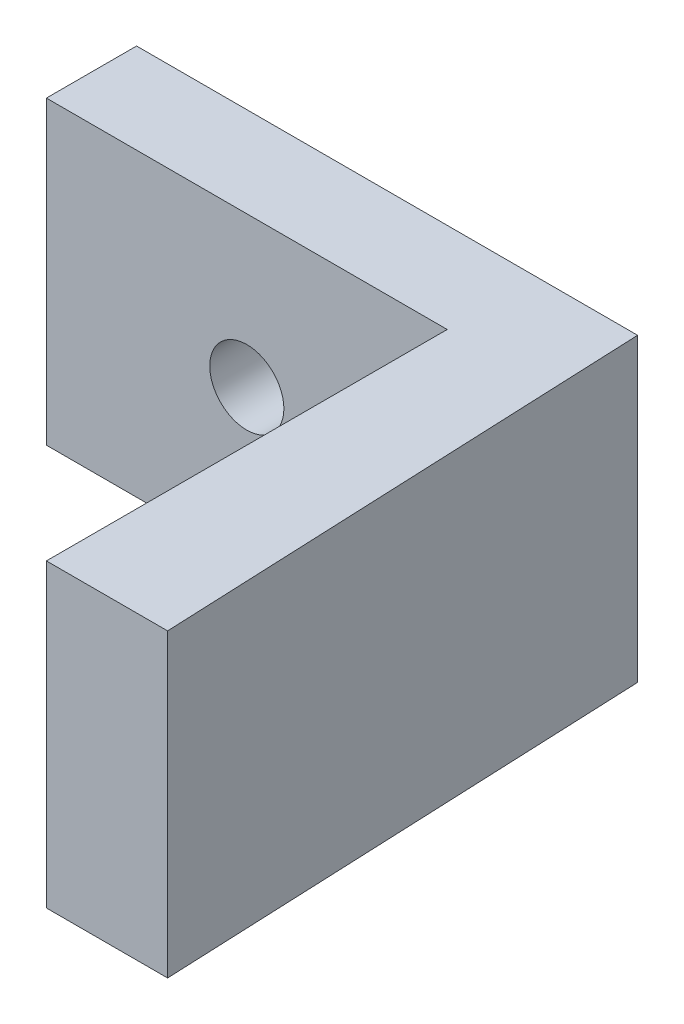
from build123d import *

# Parameters (mm, degrees)
BOSS_EXTRUDE1_DEPTH = 15
SKETCH2_R           = 1.85
CUT_EXTRUDE1_DEPTH  = 37.104189779


with BuildPart() as part:
    # Sketch1 → Boss-Extrude1 (new body)
    with BuildSketch(Plane(origin=(0, 0, 0), x_dir=(1, 0, 0), z_dir=(0, 1, 0))):
        Polygon((20, 4.5), (25, 4.5), (26.048272872, -20), (20, -20), (20, 0), (0, 0), (0, 4.5), align=None)
    extrude(amount=BOSS_EXTRUDE1_DEPTH)

    # Sketch2 → Cut-Extrude1 (cut, through all)
    with BuildSketch(Plane.XY):
        with Locations((10, 7.5)):
            Circle(SKETCH2_R)
    extrude(amount=-CUT_EXTRUDE1_DEPTH, mode=Mode.SUBTRACT)


solid = part.part
